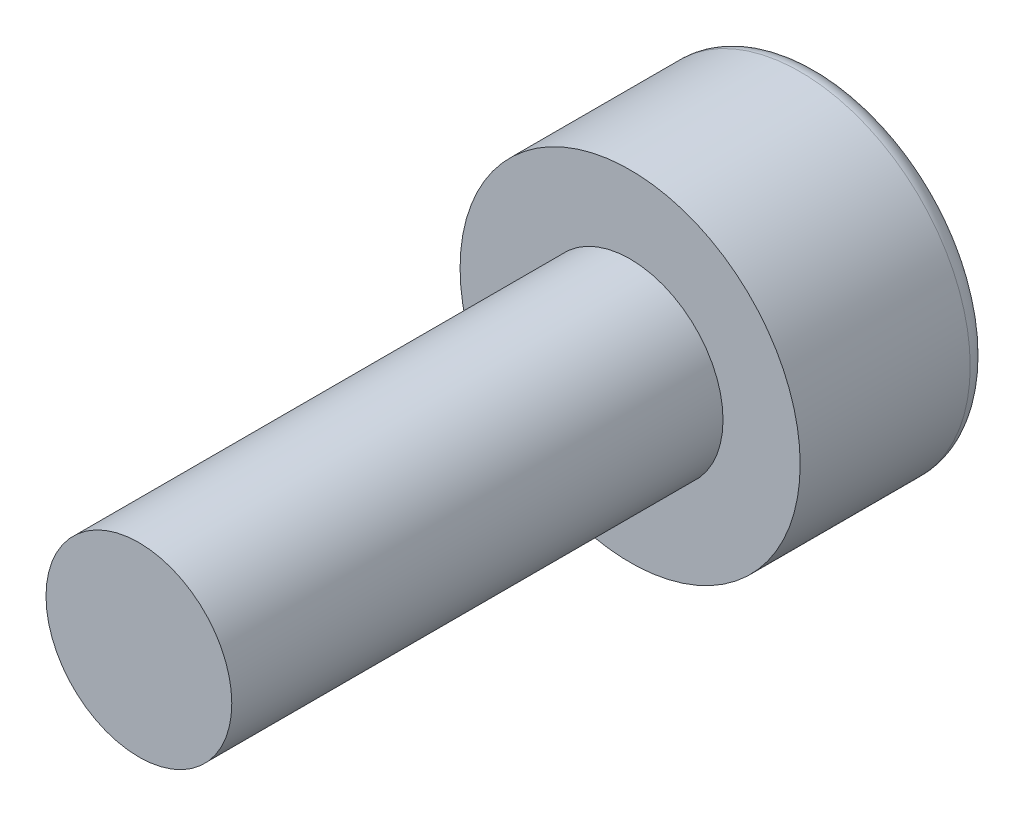
from build123d import *

# Parameters (mm, degrees)
CROQUIS1_R              = 1.475
SALIENTE_EXTRUIR1_DEPTH = 7.8
CROQUIS2_R              = 2.7
SALIENTE_EXTRUIR2_DEPTH = 3
CORTAR_EXTRUIR1_DEPTH   = 2.5
REDONDEO1_R             = 0.3


with BuildPart() as part:
    # Croquis1 → Saliente-Extruir1 (new body)
    with BuildSketch(Plane.XY):
        Circle(CROQUIS1_R)
    extrude(amount=SALIENTE_EXTRUIR1_DEPTH)

    # Croquis2 → Saliente-Extruir2 (add)
    with BuildSketch(Plane(origin=(0, 0, 0), x_dir=(-1, 0, 0), z_dir=(0, 0, -1))):
        Circle(CROQUIS2_R)
    extrude(amount=SALIENTE_EXTRUIR2_DEPTH)

    # Croquis3 → Cortar-Extruir1 (cut)
    with BuildSketch(Plane(origin=(0, 0, -3), x_dir=(-1, 0, 0), z_dir=(0, 0, -1))):
        Polygon((0, -1.776735144), (1.53869777, -0.888367572), (1.53869777, 0.888367572), (0, 1.776735144), (-1.53869777, 0.888367572), (-1.53869777, -0.888367572), align=None)
    extrude(amount=-CORTAR_EXTRUIR1_DEPTH, mode=Mode.SUBTRACT)

    # Redondeo1
    redondeo1_edges = [part.edges().sort_by_distance(p)[0] for p in [
        (2.7, 0, -3),
    ]]
    fillet(redondeo1_edges, radius=REDONDEO1_R)


solid = part.part
